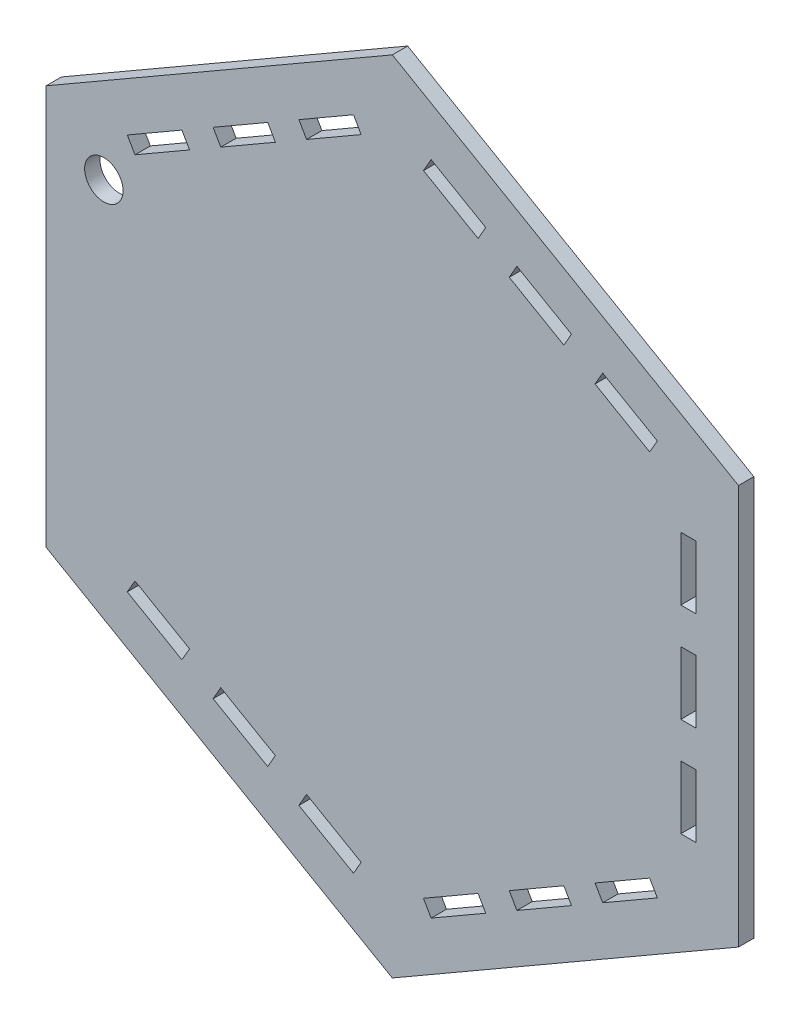
from build123d import *

# Parameters (mm, degrees)
CROQUIS1_R              = 3.75
CROQUIS1_W              = 3
CROQUIS1_H              = 12.3
SALIENTE_EXTRUIR1_DEPTH = 3


with BuildPart() as part:
    # Croquis1 → Saliente-Extruir1 (new body)
    with BuildSketch(Plane.XY):
        Polygon((94.108737778, 114.11492022), (26.558756283, 75.11492022), (26.558756283, -2.88507978), (94.108737778, -41.88507978), (161.658719273, -2.88507978), (161.658719273, 75.11492022), align=None)
        with Locations((37.817086532, 64.86492022)):
            Circle(CROQUIS1_R, mode=Mode.SUBTRACT)
        Polygon((101.681254795, 100.207027049), (100.19256624, 97.60242022), (110.844695242, 91.452410673), (112.333383798, 94.057017502), align=None, mode=Mode.SUBTRACT)
        Polygon((135.175742963, 80.868975289), (145.827871965, 74.718965742), (144.316560563, 72.12742022), (133.66443156, 78.277429767), align=None, mode=Mode.SUBTRACT)
        Polygon((133.66443156, -6.047589327), (135.175742963, -8.639134849), (145.827871965, -2.489125302), (144.316560563, 0.10242022), align=None, mode=Mode.SUBTRACT)
        Polygon((118.417179188, 90.544536596), (116.928490632, 87.939929767), (127.580619634, 81.78992022), (129.06930819, 84.394527049), align=None, mode=Mode.SUBTRACT)
        Polygon((129.06930819, -12.164686608), (118.417179188, -18.314696155), (116.928490632, -15.710089327), (127.580619634, -9.56007978), align=None, mode=Mode.SUBTRACT)
        Polygon((112.333383798, -21.827177061), (101.681254795, -27.977186608), (100.19256624, -25.37257978), (110.844695242, -19.222570233), align=None, mode=Mode.SUBTRACT)
        Polygon((77.372780314, -19.222570233), (75.884091759, -21.827177061), (86.536220761, -27.977186608), (88.024909317, -25.37257978), align=None, mode=Mode.SUBTRACT)
        Polygon((60.636855922, -9.56007978), (59.148167366, -12.164686608), (69.800296369, -18.314696155), (71.288984924, -15.710089327), align=None, mode=Mode.SUBTRACT)
        Polygon((43.900914994, 0.10242022), (54.553043996, -6.047589327), (53.041732593, -8.639134849), (42.389603591, -2.489125302), align=None, mode=Mode.SUBTRACT)
        Polygon((54.553043996, 78.277429767), (53.041732593, 80.868975289), (42.389603591, 74.718965742), (43.900914994, 72.12742022), align=None, mode=Mode.SUBTRACT)
        Polygon((59.148167366, 84.394527049), (69.800296369, 90.544536596), (71.288984924, 87.939929767), (60.636855922, 81.78992022), align=None, mode=Mode.SUBTRACT)
        Polygon((75.884091759, 94.057017502), (86.536220761, 100.207027049), (88.024909317, 97.60242022), (77.372780314, 91.452410673), align=None, mode=Mode.SUBTRACT)
        with Locations((151.900389024, 55.43992022)):
            Rectangle(CROQUIS1_W, CROQUIS1_H, mode=Mode.SUBTRACT)
        with Locations((151.900389024, 36.11492022)):
            Rectangle(CROQUIS1_W, CROQUIS1_H, mode=Mode.SUBTRACT)
        with Locations((151.900389024, 16.78992022)):
            Rectangle(CROQUIS1_W, CROQUIS1_H, mode=Mode.SUBTRACT)
    extrude(amount=SALIENTE_EXTRUIR1_DEPTH)


solid = part.part
